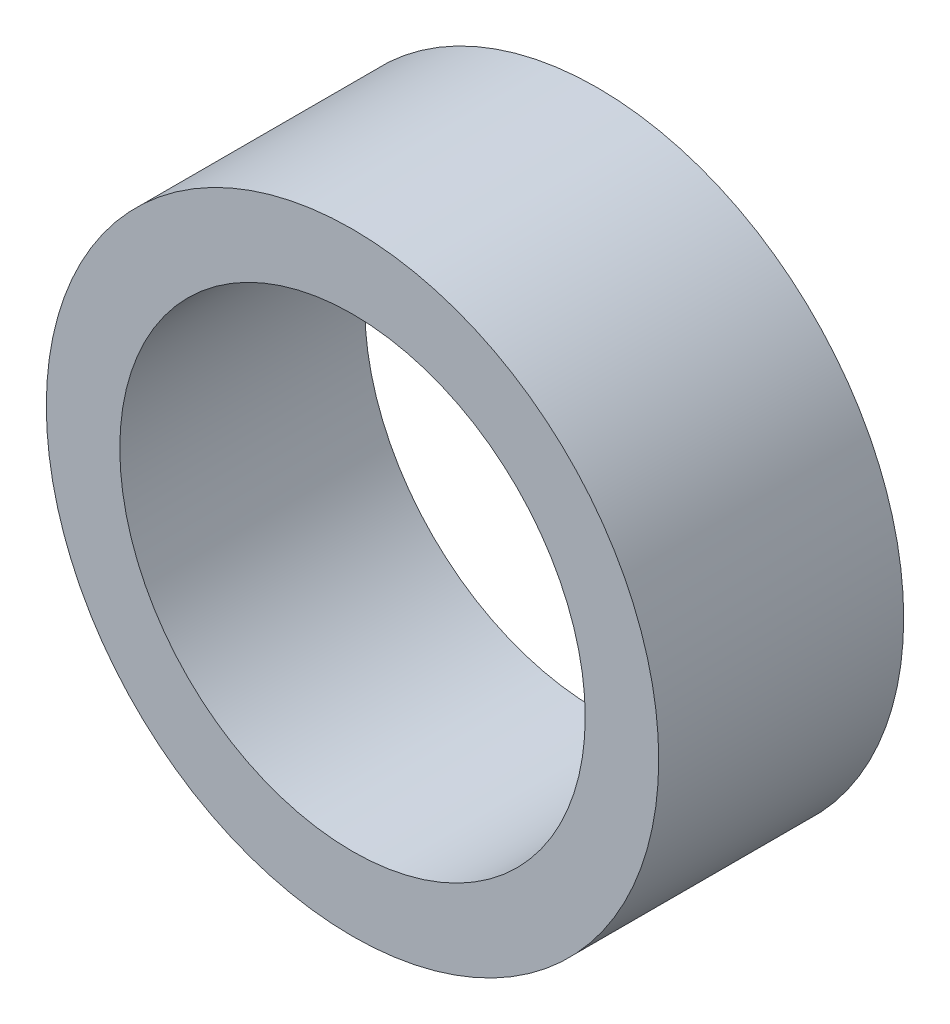
from build123d import *

# Parameters (mm, degrees)
SKETCH1_R           = 10
SKETCH1_R_2         = 7.6
BOSS_EXTRUDE1_DEPTH = 4


with BuildPart() as part:
    # Sketch1 → Boss-Extrude1 (new, symmetric)
    with BuildSketch(Plane.XY):
        Circle(SKETCH1_R)
        Circle(SKETCH1_R_2, mode=Mode.SUBTRACT)
    extrude(amount=BOSS_EXTRUDE1_DEPTH, both=True)


solid = part.part
